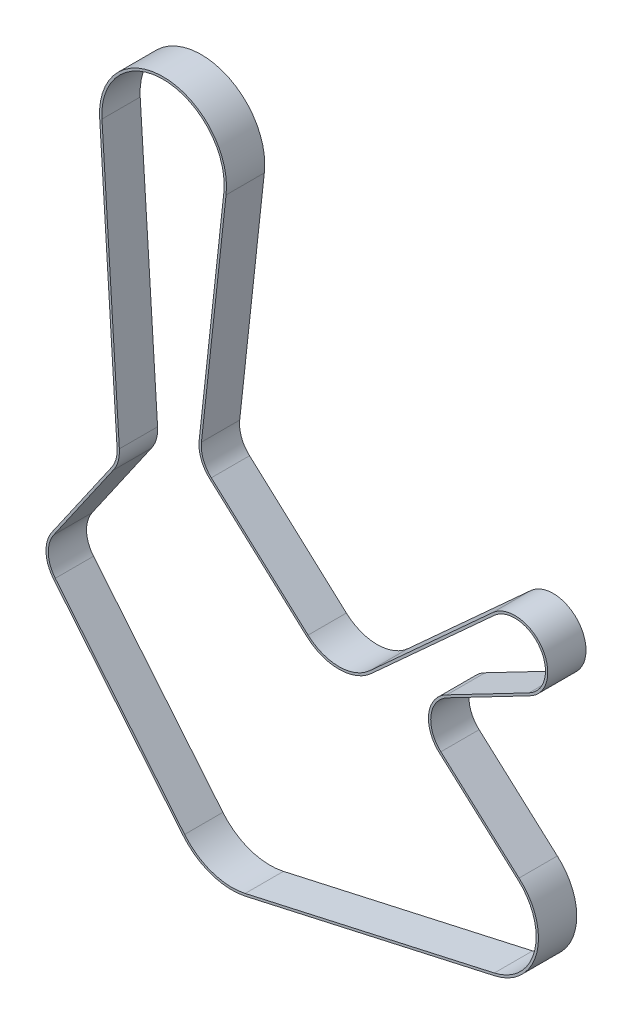
from build123d import *

# Parameters (mm, degrees)
BOSS_EXTRUDE1_DEPTH      = 12.5
BOSS_EXTRUDE1_DEPTH_BACK = 12.5


with BuildPart() as part:
    # Sketch3 → Boss-Extrude1 (new, two sides: drawn at the far end of the back side and taken through both)
    with BuildSketch(Plane.XY.offset(-BOSS_EXTRUDE1_DEPTH_BACK)):
        with BuildLine():
            Line((41.209392703, -4.902647552), (25.123270681, -152.873223024))
            ThreePointArc((25.123270681, -152.873223024), (26.308155139, -162.131131278), (31.56629724, -169.842470855))
            Line((31.56629724, -169.842470855), (94.847375791, -227.248960885))
            ThreePointArc((94.847375791, -227.248960885), (115.02027127, -235.027885849), (135.182633585, -227.221700382))
            Line((135.182633585, -227.221700382), (215.312641305, -154.332733182))
            ThreePointArc((215.312641305, -154.332733182), (247.701260572, -157.830965895), (239.450301839, -189.3457556))
            Line((239.450301839, -189.3457556), (185.765566437, -217.299410382))
            ThreePointArc((185.765566437, -217.299410382), (175.163893091, -232.519848612), (181.632970164, -249.90398677))
            Line((181.632970164, -249.90398677), (232.737634385, -295.843508488))
            ThreePointArc((232.737634385, -295.843508488), (244.347239065, -332.377604686), (216.900021711, -359.139020295))
            Line((216.900021711, -359.139020295), (54.051747266, -395.534867829))
            ThreePointArc((54.051747266, -395.534867829), (31.510113512, -394.280366061), (12.960804924, -381.410938028))
            Line((12.960804924, -381.410938028), (-71.598619136, -278.699186983))
            ThreePointArc((-71.598619136, -278.699186983), (-76.490286444, -265.680265539), (-72.389705453, -252.390948019))
            Line((-72.389705453, -252.390948019), (-33.571850395, -196.429497877))
            ThreePointArc((-33.571850395, -196.429497877), (-30.74094047, -190.403305276), (-30.045757005, -183.781691559))
            Line((-30.045757005, -183.781691559), (-41.395449867, -2.943931093))
            ThreePointArc((-41.395449867, -2.943931093), (0.983766669, 41.488338158), (41.209392703, -4.902647552))
        make_face()
        with BuildLine():
            Line((39.758565065, -4.322218299), (23.650555587, -152.494128769))
            ThreePointArc((23.650555587, -152.494128769), (24.861691641, -162.563897665), (30.554318883, -170.958008173))
            Line((30.554318883, -170.958008173), (93.835397434, -228.364498202))
            ThreePointArc((93.835397434, -228.364498202), (115.24071321, -236.533134868), (136.518688321, -228.038316235))
            Line((136.518688321, -228.038316235), (216.545640027, -155.243092274))
            ThreePointArc((216.545640027, -155.243092274), (246.399107149, -158.594576746), (239.234433563, -187.768698837))
            Line((239.234433563, -187.768698837), (185.549698161, -215.722353619))
            ThreePointArc((185.549698161, -215.722353619), (173.674724909, -232.298612729), (180.981535847, -251.335363232))
            Line((180.981535847, -251.335363232), (232.031793649, -297.225977381))
            ThreePointArc((232.031793649, -297.225977381), (242.840884818, -332.189452533), (216.571433386, -357.668796481))
            Line((216.571433386, -357.668796481), (53.72315894, -394.064644015))
            ThreePointArc((53.72315894, -394.064644015), (31.999811145, -392.855682033), (14.123862745, -380.453428312))
            Line((14.123862745, -380.453428312), (-70.435561315, -277.741677267))
            ThreePointArc((-70.435561315, -277.741677267), (-74.976572908, -265.856709803), (-71.428149605, -253.638611342))
            Line((-71.428149605, -253.638611342), (-32.610294547, -197.6771612))
            ThreePointArc((-32.610294547, -197.6771612), (-29.330340619, -190.951417289), (-28.554164527, -183.508885489))
            Line((-28.554164527, -183.508885489), (-39.91427806, -2.505089621))
            ThreePointArc((-39.91427806, -2.505089621), (0.911894069, 39.982415088), (39.758565065, -4.322218299))
        make_face(mode=Mode.SUBTRACT)
    extrude(amount=BOSS_EXTRUDE1_DEPTH + BOSS_EXTRUDE1_DEPTH_BACK)


solid = part.part
